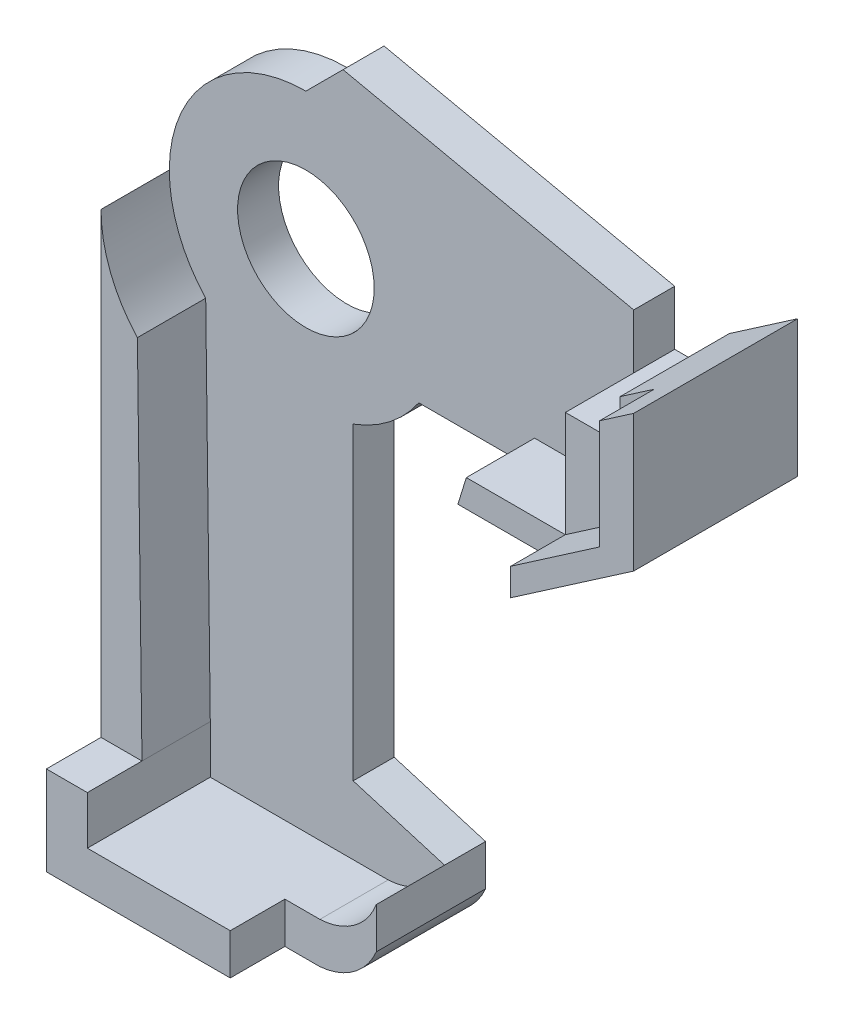
from build123d import *

# Parameters (mm, degrees)
EXTRUDE_1_DEPTH   = 6
EXTRUDE_1_2_DEPTH = 6
EXTRUDE_2_DEPTH   = 4
SKETCH_1_4_R      = 2.5
EXTRUDE_3_DEPTH   = 1.5


with BuildPart() as part:
    # 스케치1 → 보스-돌출1 (new body)
    with BuildSketch(Plane.XY):
        Polygon((-3.5, -16.737022948), (-5, -16.737022948), (-5, -20), (1.73077212, -20), (1.73077212, -18.5), (-3.5, -18.5), align=None)
    extrude(amount=EXTRUDE_1_DEPTH)



with BuildPart() as body_2:
    # 스케치1 → Extrude 1 2 (new body)
    with BuildSketch(Plane.XY):
        Polygon((15.25, 0.424756417), (11.995170544, -1.81504482), (11.995170544, -2.81504482), (16.5, 0.284940209), (16.5, 5.284940209), (15.25, 4.424756417), align=None)
    extrude(amount=EXTRUDE_1_2_DEPTH)


with BuildPart() as part_1:
    add(part.part)

    add(body_2.part)  # 보스-돌출2 merges body 2
    # 스케치1<3> → 보스-돌출2 (add)
    with BuildSketch(Plane.XY):
        with BuildLine():
            ThreePointArc((-3.667720971, -3.398208775), (-4.655029799, -1.825019883), (-5, 0))
            Line((-5, 0), (-5, -16.737022948))
            Line((-5, -16.737022948), (-3.5, -16.737022948))
            Line((-3.5, -16.737022948), (-3.667720971, -3.398208775))
        make_face()
        with BuildLine():
            Line((1.73077212, -18.5), (1.73077212, -20))
            Line((1.73077212, -20), (3.012501912, -20))
            ThreePointArc((3.012501912, -20), (4.252676388, -19.536857224), (5.075756613, -18.5))
            Line((5.075756613, -18.5), (5.075756613, -17))
            ThreePointArc((5.075756613, -17), (4.268648237, -18.058826553), (3.012501912, -18.5))
            Line((3.012501912, -18.5), (1.73077212, -18.5))
        make_face()
        Polygon((14, 2.064572624), (12, 2.064572624), (11.995170544, -1.81504482), (15.25, 0.424756417), (15.25, 4.424756417), (14, 3.564572624), align=None)
        Polygon((8.372598905, -1.81504482), (8.063712244, -2.81504482), (11.995170544, -2.81504482), (11.995170544, -1.81504482), align=None)
    extrude(amount=EXTRUDE_2_DEPTH)

    # 스케치1<4> → 보스-돌출3 (add)
    with BuildSketch(Plane.XY):
        with BuildLine():
            ThreePointArc((0, 5), (-4.582087072, 2.001119203), (-3.667720971, -3.398208775))
            Line((-3.667720971, -3.398208775), (-3.5, -16.737022948))
            Line((-3.5, -16.737022948), (-3.5, -18.5))
            Line((-3.5, -18.5), (3.012501912, -18.5))
            ThreePointArc((3.012501912, -18.5), (4.268648237, -18.058826553), (5.075756613, -17))
            Line((5.075756613, -17), (1.73077212, -16))
            Line((1.73077212, -16), (1.73077212, -4.690887749))
            ThreePointArc((1.73077212, -4.690887749), (3.0778995, -3.940372402), (4.132253945, -2.81504482))
            Line((4.132253945, -2.81504482), (8.063712244, -2.81504482))
            Line((8.063712244, -2.81504482), (8.372598905, -1.81504482))
            Line((8.372598905, -1.81504482), (11.995170544, -1.81504482))
            Line((11.995170544, -1.81504482), (12, 2.064572624))
            Line((12, 2.064572624), (12, 4.064572624))
            Line((12, 4.064572624), (1.360324879, 6.360324879))
            Line((1.360324879, 6.360324879), (0, 5))
        make_face()
        Circle(SKETCH_1_4_R, mode=Mode.SUBTRACT)
    extrude(amount=EXTRUDE_3_DEPTH)


solid = part_1.part
